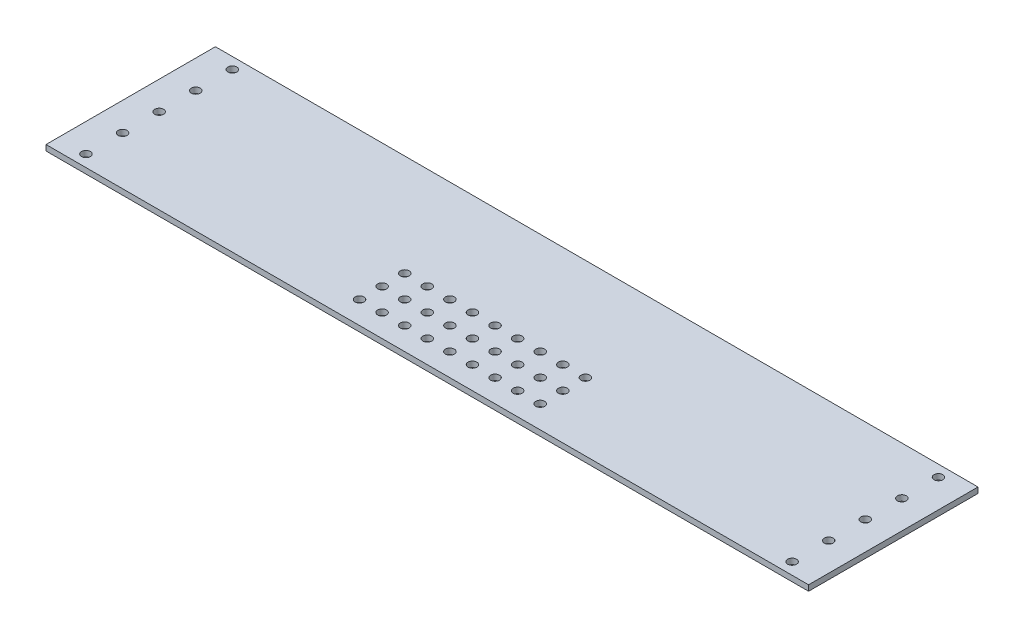
from build123d import *

# Parameters (mm, degrees)
SKETCH1_W           = 428.752
SKETCH1_H           = 95.25
SKETCH1_R           = 2.4892
BOSS_EXTRUDE1_DEPTH = 3.175
SKETCH6_R           = 2.4892
CUT_EXTRUDE1_DEPTH  = 3.175


with BuildPart() as part:
    # Sketch1 → Boss-Extrude1 (new body)
    with BuildSketch(Plane(origin=(0, 0, 0), x_dir=(1, 0, 0), z_dir=(0, 1, 0))):
        with Locations((214.376, 47.625)):
            Rectangle(SKETCH1_W, SKETCH1_H)
        with Locations(Location((15.875, 88.9, 0), (0, 0, 270))):
            Circle(SKETCH1_R, mode=Mode.SUBTRACT)
        with Locations(Location((412.877, 88.9, 0), (0, 0, 90))):
            Circle(SKETCH1_R, mode=Mode.SUBTRACT)
        with Locations(Location((15.875, 68.326, 0), (0, 0, 270))):
            Circle(SKETCH1_R, mode=Mode.SUBTRACT)
        with Locations(Location((15.875, 47.752, 0), (0, 0, 270))):
            Circle(SKETCH1_R, mode=Mode.SUBTRACT)
        with Locations(Location((15.875, 27.178, 0), (0, 0, 270))):
            Circle(SKETCH1_R, mode=Mode.SUBTRACT)
        with Locations(Location((15.875, 6.604, 0), (0, 0, 270))):
            Circle(SKETCH1_R, mode=Mode.SUBTRACT)
        with Locations(Location((412.877, 6.604, 0), (0, 0, 90))):
            Circle(SKETCH1_R, mode=Mode.SUBTRACT)
        with Locations(Location((412.877, 27.178, 0), (0, 0, 90))):
            Circle(SKETCH1_R, mode=Mode.SUBTRACT)
        with Locations(Location((412.877, 47.752, 0), (0, 0, 90))):
            Circle(SKETCH1_R, mode=Mode.SUBTRACT)
        with Locations(Location((412.877, 68.326, 0), (0, 0, 90))):
            Circle(SKETCH1_R, mode=Mode.SUBTRACT)
    extrude(amount=BOSS_EXTRUDE1_DEPTH)

    # Sketch6 → Cut-Extrude1 (cut)
    with BuildSketch(Plane(origin=(0, 0, 0), x_dir=(-1, 0, 0), z_dir=(0, -1, 0))):
        with Locations(Location((-214.376, 12.7, 0), (0, 0, 90))):
            Circle(SKETCH6_R)
        with Locations(Location((-214.376, 25.4, 0), (0, 0, 90))):
            Circle(SKETCH6_R)
        with Locations(Location((-214.376, 38.1, 0), (0, 0, 90))):
            Circle(SKETCH6_R)
        with Locations(Location((-227.076, 12.7, 0), (0, 0, 90))):
            Circle(SKETCH6_R)
        with Locations(Location((-239.776, 12.7, 0), (0, 0, 90))):
            Circle(SKETCH6_R)
        with Locations(Location((-252.476, 12.7, 0), (0, 0, 90))):
            Circle(SKETCH6_R)
        with Locations(Location((-227.076, 25.4, 0), (0, 0, 90))):
            Circle(SKETCH6_R)
        with Locations(Location((-227.076, 38.1, 0), (0, 0, 90))):
            Circle(SKETCH6_R)
        with Locations(Location((-239.776, 25.4, 0), (0, 0, 90))):
            Circle(SKETCH6_R)
        with Locations(Location((-239.776, 38.1, 0), (0, 0, 90))):
            Circle(SKETCH6_R)
        with Locations(Location((-252.476, 25.4, 0), (0, 0, 90))):
            Circle(SKETCH6_R)
        with Locations(Location((-252.476, 38.1, 0), (0, 0, 90))):
            Circle(SKETCH6_R)
        with Locations(Location((-201.676, 12.7, 0), (0, 0, 90))):
            Circle(SKETCH6_R)
        with Locations(Location((-201.676, 25.4, 0), (0, 0, 90))):
            Circle(SKETCH6_R)
        with Locations(Location((-201.676, 38.1, 0), (0, 0, 90))):
            Circle(SKETCH6_R)
        with Locations(Location((-188.976, 12.7, 0), (0, 0, 90))):
            Circle(SKETCH6_R)
        with Locations(Location((-188.976, 25.4, 0), (0, 0, 90))):
            Circle(SKETCH6_R)
        with Locations(Location((-188.976, 38.1, 0), (0, 0, 90))):
            Circle(SKETCH6_R)
        with Locations(Location((-176.276, 12.7, 0), (0, 0, 90))):
            Circle(SKETCH6_R)
        with Locations(Location((-176.276, 25.4, 0), (0, 0, 90))):
            Circle(SKETCH6_R)
        with Locations(Location((-176.276, 38.1, 0), (0, 0, 90))):
            Circle(SKETCH6_R)
        with Locations(Location((-163.576, 12.7, 0), (0, 0, 90))):
            Circle(SKETCH6_R)
        with Locations(Location((-163.576, 25.4, 0), (0, 0, 90))):
            Circle(SKETCH6_R)
        with Locations(Location((-163.576, 38.1, 0), (0, 0, 90))):
            Circle(SKETCH6_R)
        with Locations(Location((-265.176, 25.4, 0), (0, 0, 90))):
            Circle(SKETCH6_R)
        with Locations(Location((-265.176, 38.1, 0), (0, 0, 90))):
            Circle(SKETCH6_R)
        with Locations(Location((-265.176, 12.7, 0), (0, 0, 90))):
            Circle(SKETCH6_R)
    extrude(amount=-CUT_EXTRUDE1_DEPTH, mode=Mode.SUBTRACT)


solid = part.part
